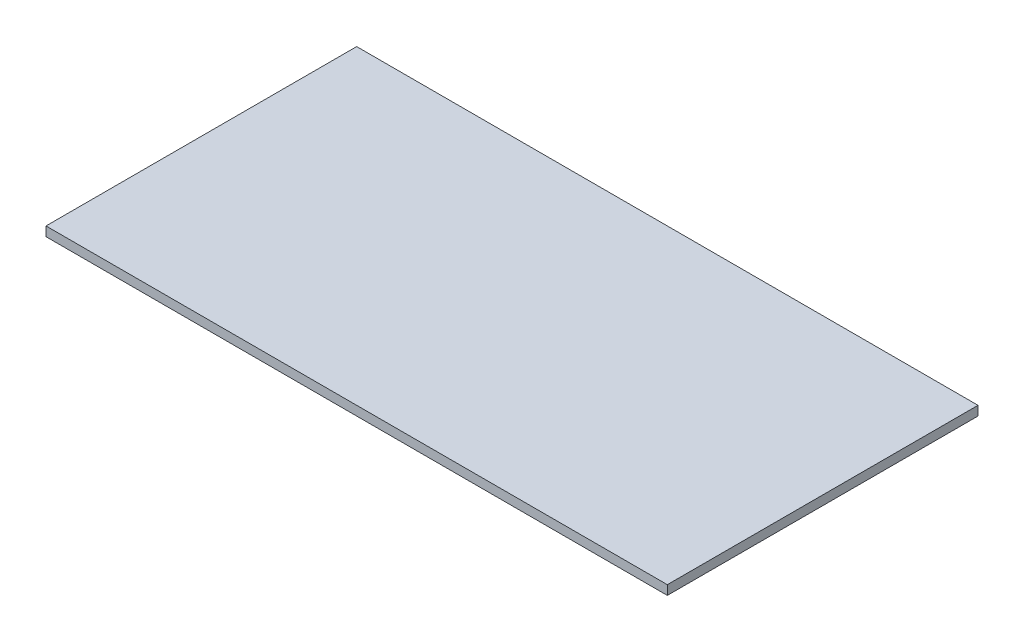
from build123d import *

# Parameters (mm, degrees)
SKETCH_1_W    = 200
SKETCH_1_H    = 100
CS_BASE_DEPTH = 3


with BuildPart() as part:
    # Эскиз1 → CS_BASE (new body)
    with BuildSketch(Plane(origin=(0, 0, 0), x_dir=(1, 0, 0), z_dir=(0, 1, 0))):
        Rectangle(SKETCH_1_W, SKETCH_1_H)
    extrude(amount=CS_BASE_DEPTH)


solid = part.part
